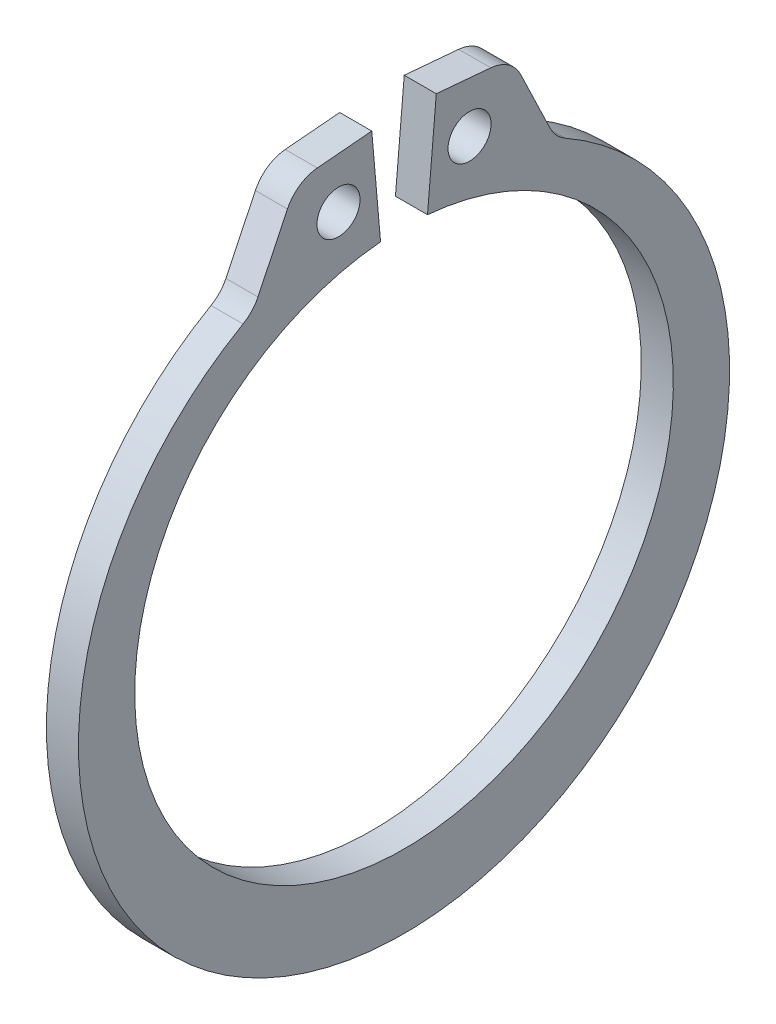
from build123d import *

# Parameters (mm, degrees)
SKETCH1_R      = 0.5969
EXTRUDE1_DEPTH = 0.4445
FILLET1_R      = 1.016


with BuildPart() as part:
    # Sketch1 → Extrude1 (new, symmetric)
    with BuildSketch(Plane(origin=(0, 0, 0), x_dir=(0, 0, -1), z_dir=(1, 0, 0))):
        with BuildLine():
            Line((-0.650844225, 7.439183527), (-0.89435737, 10.222551514))
            Line((-0.89435737, 10.222551514), (-2.98188336, 10.039916655))
            Line((-2.98188336, 10.039916655), (-4.191712054, 7.521434864))
            ThreePointArc((-4.191712054, 7.521434864), (0, -9.4996), (4.191712054, 7.521434864))
            Line((4.191712054, 7.521434864), (2.98188336, 10.039916655))
            Line((2.98188336, 10.039916655), (0.89435737, 10.222551514))
            Line((0.89435737, 10.222551514), (0.650844225, 7.439183527))
            ThreePointArc((0.650844225, 7.439183527), (0, -7.4676), (-0.650844225, 7.439183527))
        make_face()
        with Locations((-1.816363792, 8.739550091)):
            Circle(SKETCH1_R, mode=Mode.SUBTRACT)
        with Locations((1.816363792, 8.739550091)):
            Circle(SKETCH1_R, mode=Mode.SUBTRACT)
    extrude(amount=EXTRUDE1_DEPTH, both=True)

    # Fillet1
    fillet1_edges = [part.edges().sort_by_distance(p)[0] for p in [
        (0, 10.039916655, -2.98188336),
        (0, 7.521434864, -4.191712054),
        (0, 7.521434864, 4.191712054),
        (0, 10.039916655, 2.98188336),
    ]]
    fillet(fillet1_edges, radius=FILLET1_R)


solid = part.part
